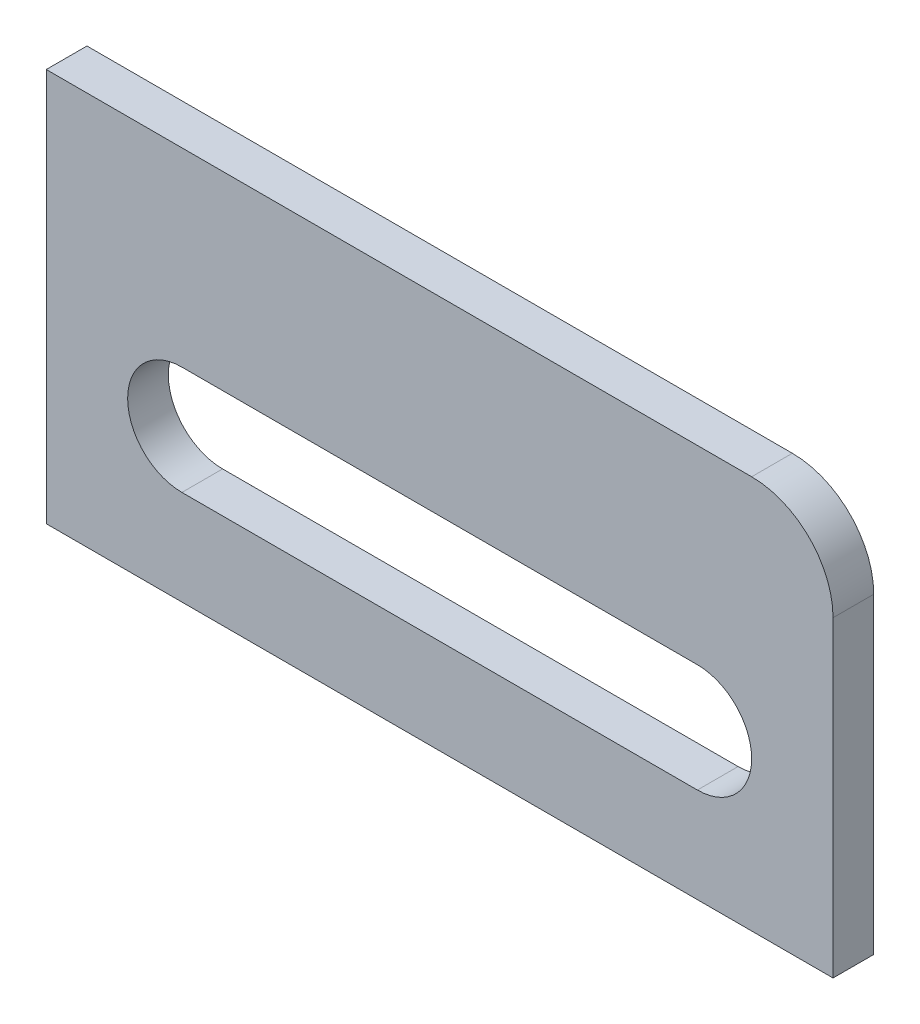
from build123d import *

# Parameters (mm, degrees)
BOSS_EXTRUDE1_DEPTH = 3
CUT_EXTRUDE2_DEPTH  = 10


with BuildPart() as part:
    # Sketch1 → Boss-Extrude1 (new body)
    with BuildSketch(Plane.XY):
        with BuildLine():
            Line((0, 29), (52, 29))
            ThreePointArc((52, 29), (56.242640687, 27.242640687), (58, 23))
            Line((58, 23), (58, 0))
            Line((58, 0), (0, 0))
            Line((0, 0), (0, 29))
        make_face()
    extrude(amount=BOSS_EXTRUDE1_DEPTH)

    # Sketch4 → Cut-Extrude2 (cut)
    with BuildSketch(Plane.XY.offset(3)):
        with BuildLine():
            Line((10, 15), (48, 15))
            ThreePointArc((48, 15), (52, 11), (48, 7))
            Line((48, 7), (10, 7))
            ThreePointArc((10, 7), (6, 11), (10, 15))
        make_face()
    extrude(amount=-CUT_EXTRUDE2_DEPTH, mode=Mode.SUBTRACT)


solid = part.part
